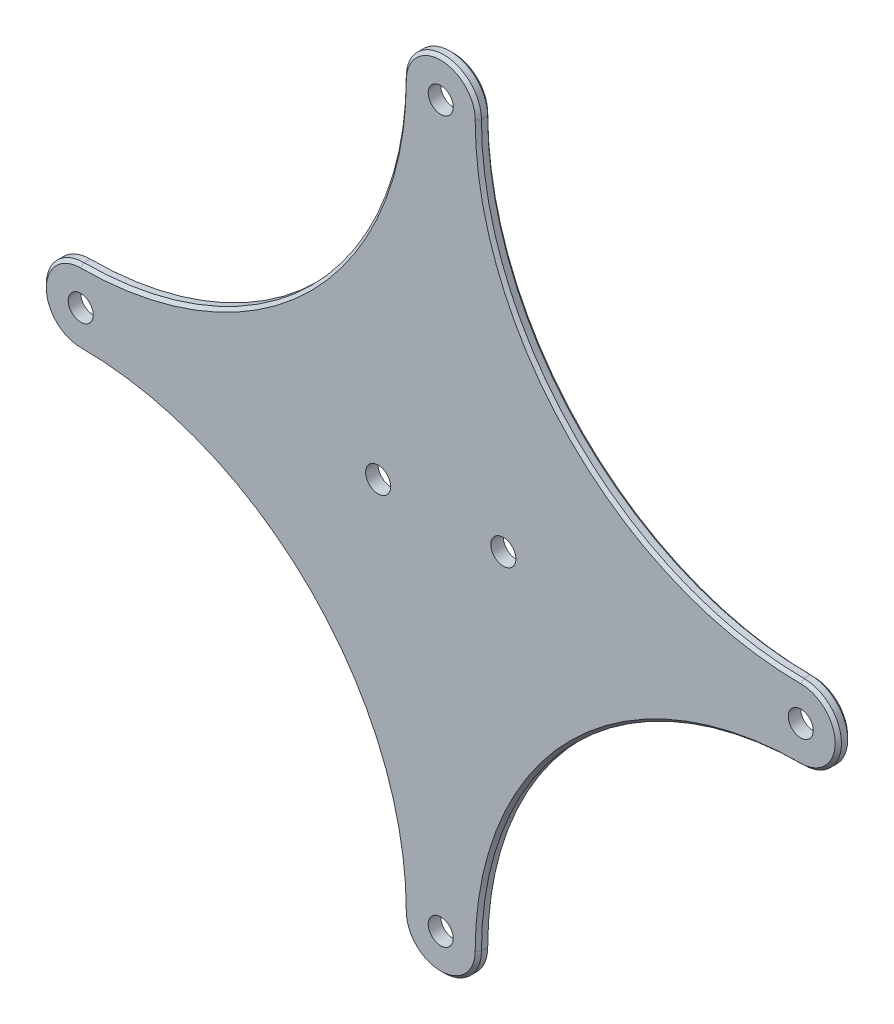
from build123d import *

# Parameters (mm, degrees)
IZIM1_R                     = 132.5
IZIM1_R_2                   = 4
Y_KSEKLIK_EKSTR_ZYON1_DEPTH = 4
SKETCH1_R                   = 147.896519427
CUT_EXTRUDE2_DEPTH          = 10
CHAMFER1_SIZE               = 1


with BuildPart() as part:
    # Çizim1 → Yükseklik-Ekstrüzyon1 (new body)
    with BuildSketch(Plane.XY):
        Circle(IZIM1_R)
        with Locations((0, 115)):
            Circle(IZIM1_R_2, mode=Mode.SUBTRACT)
        with Locations((115, 0)):
            Circle(IZIM1_R_2, mode=Mode.SUBTRACT)
        with Locations((0, -115)):
            Circle(IZIM1_R_2, mode=Mode.SUBTRACT)
        with Locations((-115, 0)):
            Circle(IZIM1_R_2, mode=Mode.SUBTRACT)
        with Locations((-20, 0)):
            Circle(IZIM1_R_2, mode=Mode.SUBTRACT)
        with Locations((20, 0)):
            Circle(IZIM1_R_2, mode=Mode.SUBTRACT)
    extrude(amount=Y_KSEKLIK_EKSTR_ZYON1_DEPTH)

    # Sketch1 → Cut-Extrude2 (cut)
    with BuildSketch(Plane.XY.offset(4)):
        Circle(SKETCH1_R)
        with BuildLine():
            ThreePointArc((12, 115), (0, 127), (-12, 115))
            ThreePointArc((-12, 115), (-42.168001538, 42.168001538), (-115, 12))
            ThreePointArc((-115, 12), (-127, 0), (-115, -12))
            ThreePointArc((-115, -12), (-42.168001538, -42.168001538), (-12, -115))
            ThreePointArc((-12, -115), (0, -127), (12, -115))
            ThreePointArc((12, -115), (42.168001538, -42.168001538), (115, -12))
            ThreePointArc((115, -12), (127, 0), (115, 12))
            ThreePointArc((115, 12), (42.168001538, 42.168001538), (12, 115))
        make_face(mode=Mode.SUBTRACT)
    extrude(amount=-CUT_EXTRUDE2_DEPTH, mode=Mode.SUBTRACT)

    # Chamfer1
    chamfer1_edges = [part.edges().sort_by_distance(p)[0] for p in [
        (127, 0, 0),
        (42.168001538, 42.168001538, 0),
        (0, 127, 0),
        (-42.168001538, 42.168001538, 0),
        (-127, 0, 0),
        (-42.168001538, -42.168001538, 0),
        (0, -127, 0),
        (42.168001538, -42.168001538, 0),
        (-42.168001538, -42.168001538, 4),
        (-127, 0, 4),
        (0, 127, 4),
        (42.168001538, 42.168001538, 4),
        (127, 0, 4),
        (42.168001538, -42.168001538, 4),
        (0, -127, 4),
        (-42.168001538, 42.168001538, 4),
    ]]
    chamfer(chamfer1_edges, length=CHAMFER1_SIZE)


solid = part.part
